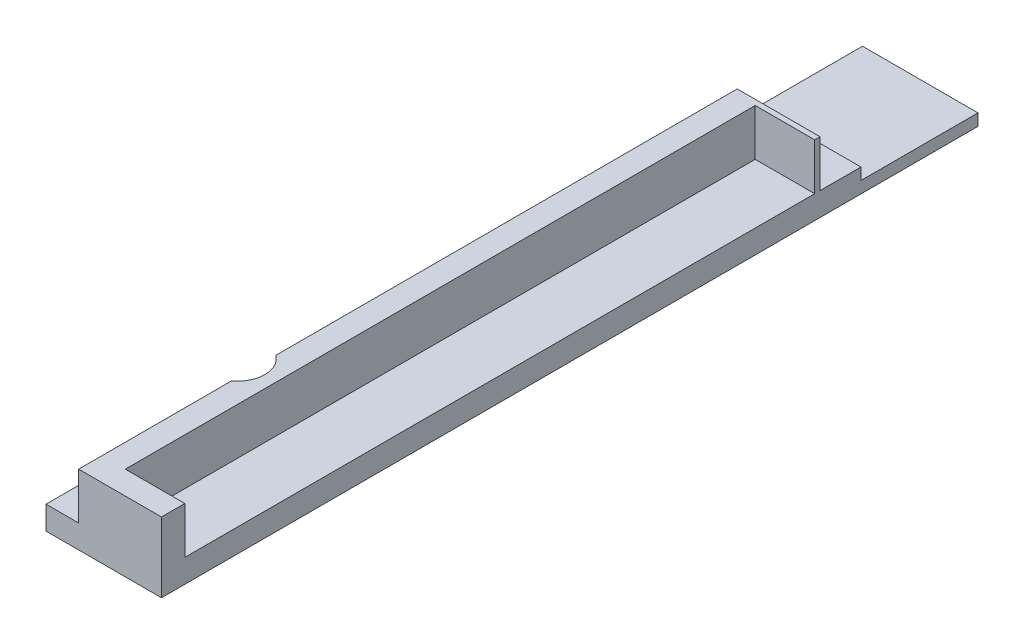
from build123d import *

# Parameters (mm, degrees)
SKETCH1_W           = 25.146
SKETCH1_H           = 177.8
BOSS_EXTRUDE1_DEPTH = 5.08
BOSS_EXTRUDE3_DEPTH = 10.16
SKETCH4_W           = 25.146
SKETCH4_H           = 25.485835905
CUT_EXTRUDE1_DEPTH  = 2.54
SKETCH5_R           = 3
CUT_EXTRUDE2_DEPTH  = 133.167293803
SKETCH6_R           = 6
SKETCH6_R_2         = 3
CUT_EXTRUDE3_DEPTH  = 16.51
CUT_EXTRUDE4_DEPTH  = 133.167293803


with BuildPart() as part:
    # Sketch1 → Boss-Extrude1 (new body)
    with BuildSketch(Plane(origin=(0, 0, 0), x_dir=(1, 0, 0), z_dir=(0, 1, 0))):
        with Locations((-33.02, -34.737560241)):
            Rectangle(SKETCH1_W, SKETCH1_H)
    extrude(amount=BOSS_EXTRUDE1_DEPTH)

    # Sketch3 → Boss-Extrude3 (add)
    with BuildSketch(Plane(origin=(0, 5.08, 0), x_dir=(1, 0, 0), z_dir=(0, 1, 0))):
        Polygon((-38.481, -123.637560241), (-20.447, -123.637560241), (-20.447, -118.557560241), (-33.401, -118.557560241), (-33.401, 18.602439759), (-20.447, 18.602439759), (-20.447, 19.76859762), (-38.481, 19.76859762), align=None)
    extrude(amount=BOSS_EXTRUDE3_DEPTH)

    # Sketch4 → Cut-Extrude1 (cut)
    with BuildSketch(Plane(origin=(0, 5.08, 0), x_dir=(1, 0, 0), z_dir=(0, 1, 0))):
        with Locations((-33.02, 41.419521807)):
            Rectangle(SKETCH4_W, SKETCH4_H)
    extrude(amount=-CUT_EXTRUDE1_DEPTH, mode=Mode.SUBTRACT)

    # Sketch5 → Cut-Extrude2 (cut, through all)
    with BuildSketch(Plane(origin=(0, 5.08, 0), x_dir=(1, 0, 0), z_dir=(0, 1, 0))):
        with Locations(Location((-33.02, 24.222600737, 0), (0, 0, 270))):
            Circle(SKETCH5_R)
    extrude(amount=-CUT_EXTRUDE2_DEPTH, mode=Mode.SUBTRACT)

    # Sketch6 → Cut-Extrude3 (cut)
    with BuildSketch(Plane(origin=(0, 5.08, 0), x_dir=(1, 0, 0), z_dir=(0, 1, 0))):
        with Locations((-42.037, -85.537560241)):
            Circle(SKETCH6_R)
        with Locations((-42.037, -85.537560241)):
            Circle(SKETCH6_R_2, mode=Mode.SUBTRACT)
    extrude(amount=CUT_EXTRUDE3_DEPTH, mode=Mode.SUBTRACT)

    # Sketch6<3> → Cut-Extrude4 (cut, through all)
    with BuildSketch(Plane(origin=(0, 5.08, 0), x_dir=(1, 0, 0), z_dir=(0, 1, 0))):
        with BuildLine():
            ThreePointArc((-42.037, -82.537560241), (-45.037, -85.537560241), (-42.037, -88.537560241))
            Line((-42.037, -88.537560241), (-42.037, -82.537560241))
        make_face()
        with BuildLine():
            Line((-42.037, -82.537560241), (-42.037, -88.537560241))
            ThreePointArc((-42.037, -88.537560241), (-39.915679656, -87.658880585), (-39.037, -85.537560241))
            ThreePointArc((-39.037, -85.537560241), (-39.915679656, -83.416239897), (-42.037, -82.537560241))
        make_face()
    extrude(amount=-CUT_EXTRUDE4_DEPTH, mode=Mode.SUBTRACT)


solid = part.part
